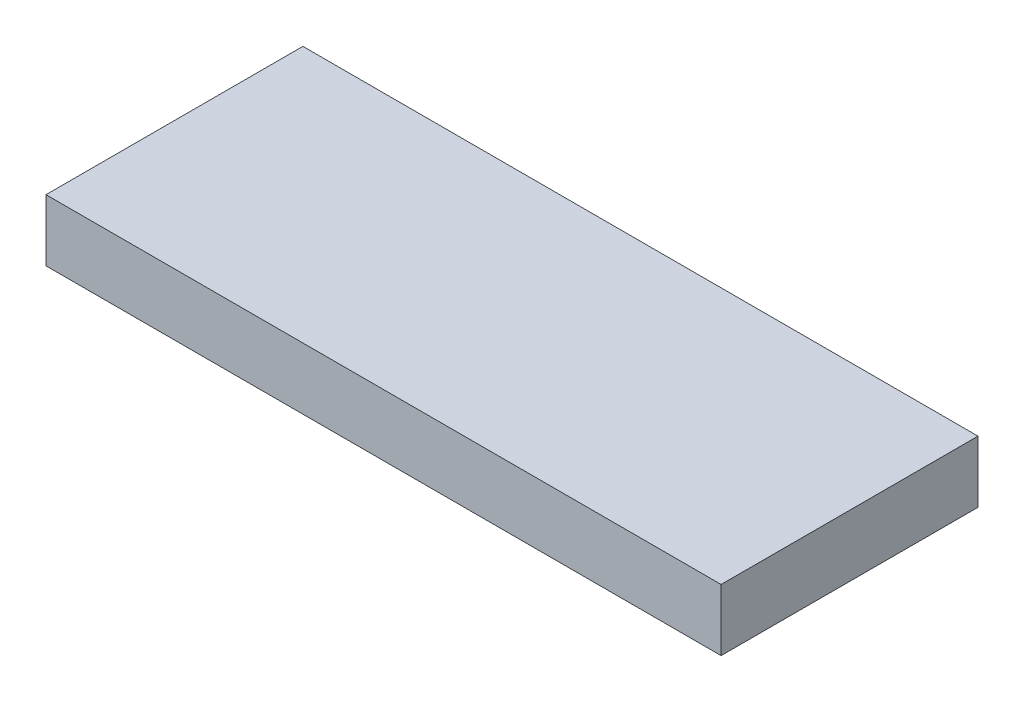
from build123d import *

# Parameters (mm, degrees)
SKETCH_1_W      = 39.42
SKETCH_1_H      = 3.6
EXTRUDE_1_DEPTH = 15


with BuildPart() as part:
    # 草图1 → 凸台-拉伸1 (new body)
    with BuildSketch(Plane.XY):
        with Locations((0, 1.8)):
            Rectangle(SKETCH_1_W, SKETCH_1_H)
    extrude(amount=EXTRUDE_1_DEPTH)


solid = part.part
